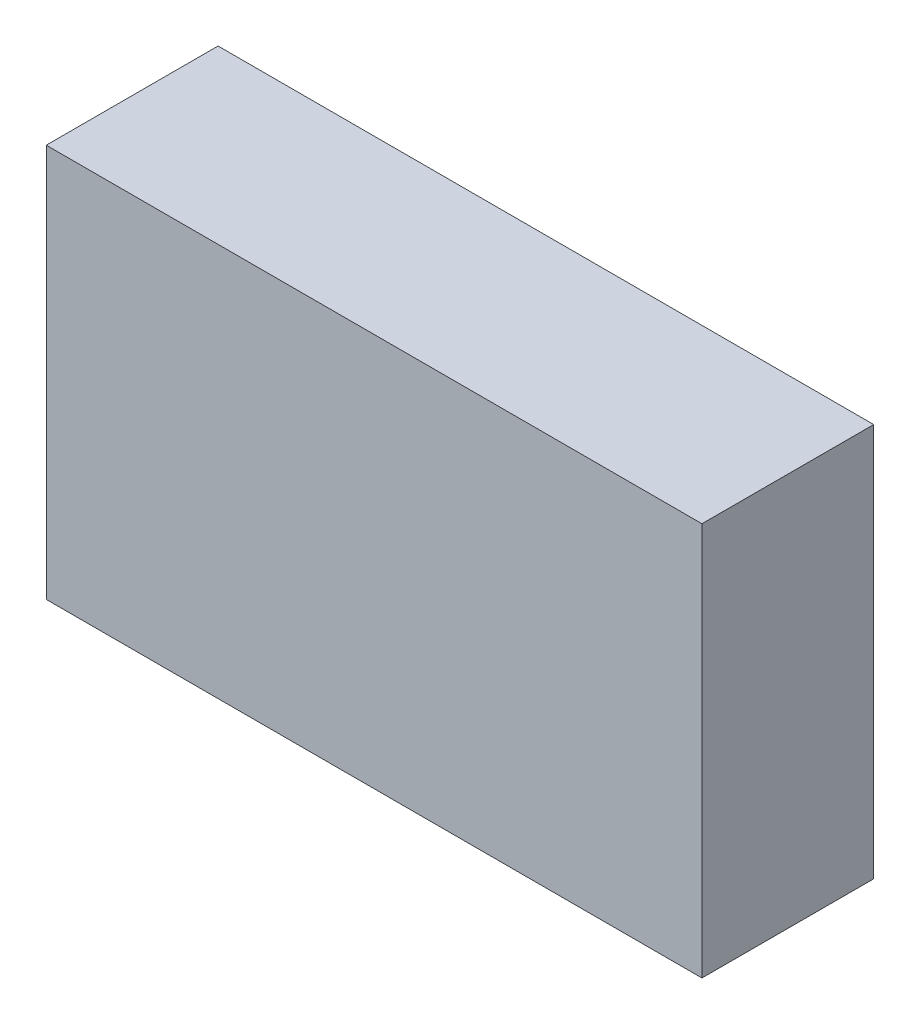
from build123d import *

# Parameters (mm, degrees)
SKETCH1_W           = 150
SKETCH1_H           = 90
BOSS_EXTRUDE1_DEPTH = 39.3


with BuildPart() as part:
    # Sketch1 → Boss-Extrude1 (new body)
    with BuildSketch(Plane.XY):
        Rectangle(SKETCH1_W, SKETCH1_H)
    extrude(amount=BOSS_EXTRUDE1_DEPTH)


solid = part.part
